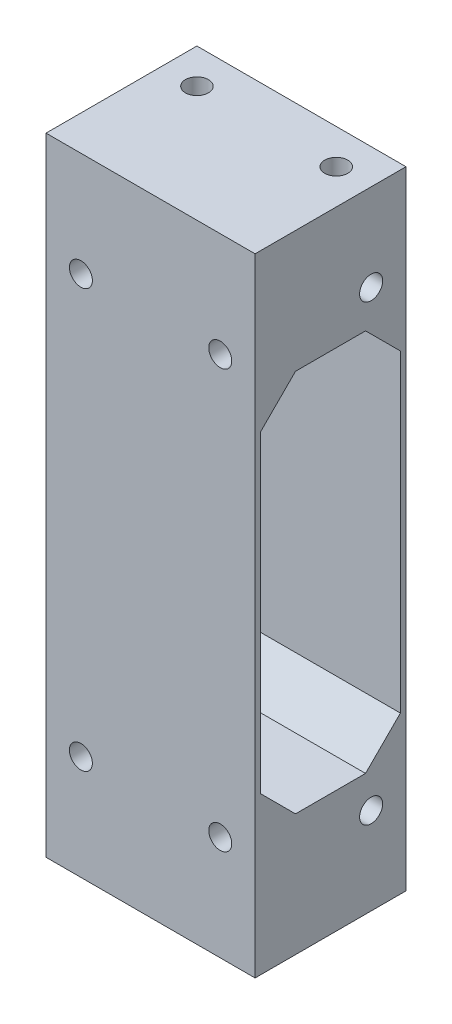
from build123d import *

# Parameters (mm, degrees)
SKETCH1_W                 = 30
SKETCH1_H                 = 21.65
BOSS_EXTRUDE1_DEPTH       = 90
M4X0_7_TAPPED_HOLE1_D     = 3.3
M4X0_7_TAPPED_HOLE1_DEPTH = 10
M4X0_7_TAPPED_HOLE1_TIP   = 0.991420021
M4X0_7_TAPPED_HOLE2_D     = 3.3
M4X0_7_TAPPED_HOLE2_DEPTH = 12
M4X0_7_TAPPED_HOLE2_TIP   = 0.991420021
SKETCH7_W                 = 20.05
SKETCH7_H                 = 55
CUT_EXTRUDE1_DEPTH        = 96.483928622
CHAMFER1_SIZE             = 5
M4X0_7_TAPPED_HOLE3_D     = 3.3
M4X0_7_TAPPED_HOLE3_DEPTH = 10
M4X0_7_TAPPED_HOLE3_TIP   = 0.991420021
M4X0_7_TAPPED_HOLE4_D     = 3.3
M4X0_7_TAPPED_HOLE4_DEPTH = 8
M4X0_7_TAPPED_HOLE4_TIP   = 0.991420021


with BuildPart() as part:
    # Sketch1 → Boss-Extrude1 (new body)
    with BuildSketch(Plane(origin=(0, 0, 0), x_dir=(1, 0, 0), z_dir=(0, 1, 0))):
        Rectangle(SKETCH1_W, SKETCH1_H)
    extrude(amount=BOSS_EXTRUDE1_DEPTH)

    # M4x0.7 Tapped Hole1
    with Locations(Plane(origin=(0, 90, 0), x_dir=(1, 0, 0), z_dir=(0, 1, 0))):
        with Locations((-10, 5.825), (10, 5.825)):
            Hole(M4X0_7_TAPPED_HOLE1_D / 2, depth=M4X0_7_TAPPED_HOLE1_DEPTH)
            with Locations((0, 0, -(M4X0_7_TAPPED_HOLE1_DEPTH + M4X0_7_TAPPED_HOLE1_TIP / 2))):  # 118° drill point
                Cone(0, M4X0_7_TAPPED_HOLE1_D / 2, M4X0_7_TAPPED_HOLE1_TIP, mode=Mode.SUBTRACT)

    # M4x0.7 Tapped Hole2
    with Locations(Plane(origin=(0, 0, 0), x_dir=(-1, 0, 0), z_dir=(0, -1, 0))):
        with Locations((-10, -0.825), (10, -0.825)):
            Hole(M4X0_7_TAPPED_HOLE2_D / 2, depth=M4X0_7_TAPPED_HOLE2_DEPTH)
            with Locations((0, 0, -(M4X0_7_TAPPED_HOLE2_DEPTH + M4X0_7_TAPPED_HOLE2_TIP / 2))):  # 118° drill point
                Cone(0, M4X0_7_TAPPED_HOLE2_D / 2, M4X0_7_TAPPED_HOLE2_TIP, mode=Mode.SUBTRACT)

    # Sketch7 → Cut-Extrude1 (cut, through all)
    with BuildSketch(Plane(origin=(15, 0, 0), x_dir=(0, 0, -1), z_dir=(1, 0, 0))):
        with Locations((0, 45)):
            Rectangle(SKETCH7_W, SKETCH7_H)
    extrude(amount=-CUT_EXTRUDE1_DEPTH, mode=Mode.SUBTRACT)

    # Chamfer1
    chamfer1_edges = [part.edges().sort_by_distance(p)[0] for p in [
        (0, 72.5, -10.025),
        (0, 17.5, -10.025),
        (0, 17.5, 10.025),
        (0, 72.5, 10.025),
    ]]
    chamfer(chamfer1_edges, length=CHAMFER1_SIZE)

    # M4x0.7 Tapped Hole3
    with Locations(Plane.XY.offset(10.825)):
        with Locations((-10, 15), (10, 15), (10, 75), (-10, 75)):
            Hole(M4X0_7_TAPPED_HOLE3_D / 2, depth=M4X0_7_TAPPED_HOLE3_DEPTH)
            with Locations((0, 0, -(M4X0_7_TAPPED_HOLE3_DEPTH + M4X0_7_TAPPED_HOLE3_TIP / 2))):  # 118° drill point
                Cone(0, M4X0_7_TAPPED_HOLE3_D / 2, M4X0_7_TAPPED_HOLE3_TIP, mode=Mode.SUBTRACT)

    # M4x0.7 Tapped Hole4
    with Locations(Plane(origin=(15, 0, 0), x_dir=(0, 0, -1), z_dir=(1, 0, 0))):
        with Locations((5.825, 12.5), (5.825, 77.5)):
            Hole(M4X0_7_TAPPED_HOLE4_D / 2, depth=M4X0_7_TAPPED_HOLE4_DEPTH)
            with Locations((0, 0, -(M4X0_7_TAPPED_HOLE4_DEPTH + M4X0_7_TAPPED_HOLE4_TIP / 2))):  # 118° drill point
                Cone(0, M4X0_7_TAPPED_HOLE4_D / 2, M4X0_7_TAPPED_HOLE4_TIP, mode=Mode.SUBTRACT)


solid = part.part
